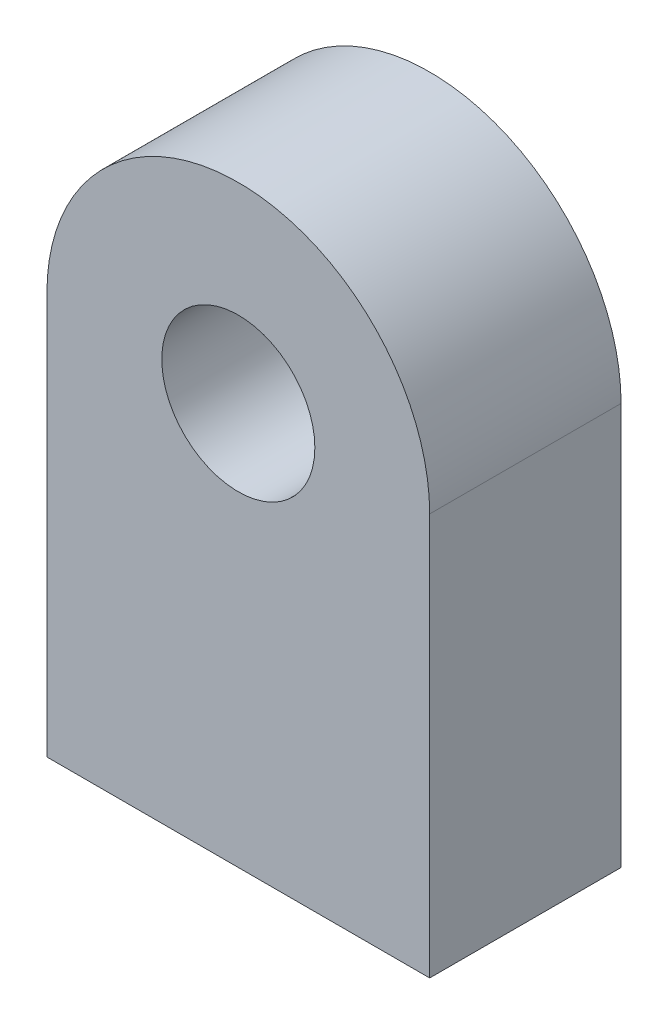
from build123d import *

# Parameters (mm, degrees)
EXTRUDE_1_DEPTH = 10


with BuildPart() as part:
    # 스케치1 → 보스-돌출1 (new body)
    with BuildSketch(Plane.XY):
        with BuildLine():
            ThreePointArc((10, 21), (0, 31), (-10, 21))
            Line((-10, 21), (-4, 21))
            ThreePointArc((-4, 21), (0, 25), (4, 21))
            Line((4, 21), (10, 21))
        make_face()
        with BuildLine():
            ThreePointArc((-10, 21), (-7.071067812, 13.928932188), (0, 11))
            Line((0, 11), (0, 17))
            ThreePointArc((0, 17), (-2.828427125, 18.171572875), (-4, 21))
            Line((-4, 21), (-10, 21))
        make_face()
        with BuildLine():
            Line((0, 17), (0, 11))
            ThreePointArc((0, 11), (7.071067812, 13.928932188), (10, 21))
            Line((10, 21), (4, 21))
            ThreePointArc((4, 21), (2.828427125, 18.171572875), (0, 17))
        make_face()
        with BuildLine():
            Line((0, 11), (0, 0))
            Line((0, 0), (10, 0))
            Line((10, 0), (10, 21))
            ThreePointArc((10, 21), (7.071067812, 13.928932188), (0, 11))
        make_face()
        with BuildLine():
            Line((-10, 0), (0, 0))
            Line((0, 0), (0, 11))
            ThreePointArc((0, 11), (-7.071067812, 13.928932188), (-10, 21))
            Line((-10, 21), (-10, 0))
        make_face()
    extrude(amount=EXTRUDE_1_DEPTH)


solid = part.part
